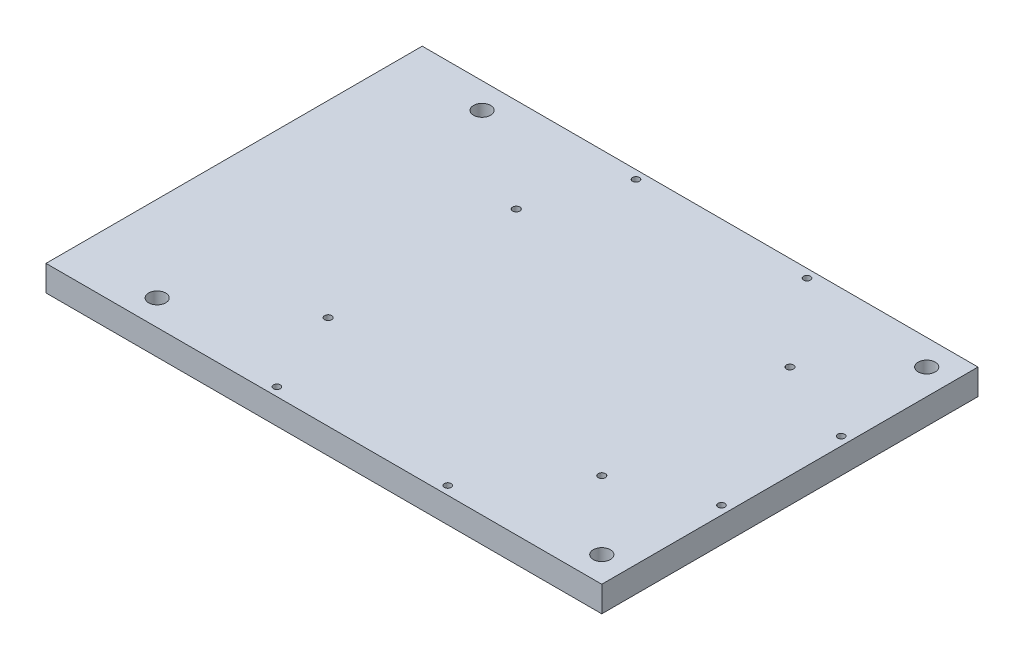
from build123d import *

# Parameters (mm, degrees)
SKETCH2_R                                    = 5
BOSS_EXTRUDE3_DEPTH                          = 15
SKETCH11_W                                   = 50
SKETCH11_H                                   = 75
SKETCH11_W_2                                 = 70
SKETCH11_H_2                                 = 90
CUT_EXTRUDE6_DEPTH                           = 5
FILLET1_R                                    = 5
CSK_FOR_M4_COUNTERSUNK_FLAT_HEAD_SCR_2_COUNT = 2
CSK_FOR_M4_COUNTERSUNK_FLAT_HEAD_SCR_2_PITCH = 100
CSK_FOR_M4_COUNTERSUNK_FLAT_HEAD_SCR_3_COUNT = 2
CSK_FOR_M4_COUNTERSUNK_FLAT_HEAD_SCR_3_PITCH = 202.484567313
CSK_FOR_M4_COUNTERSUNK_FLAT_HEAD_SCR_4_COUNT = 2
CSK_FOR_M4_COUNTERSUNK_FLAT_HEAD_SCR_4_PITCH = 236.008474424
CSK_FOR_M4_COUNTERSUNK_FLAT_HEAD_SCR_5_COUNT = 2
CSK_FOR_M4_COUNTERSUNK_FLAT_HEAD_SCR_5_PITCH = 232.594066992
CSK_FOR_M4_COUNTERSUNK_FLAT_HEAD_SCR_6_COUNT = 2
CSK_FOR_M4_COUNTERSUNK_FLAT_HEAD_SCR_6_PITCH = 210
M5_TAPPED_HOLE2_D                            = 4.2
M5_TAPPED_HOLE2_DEPTH                        = 5
M5_TAPPED_HOLE2_TIP                          = 1.2618073
M6_TAPPED_HOLE3_D                            = 5
M6_TAPPED_HOLE3_DEPTH                        = 5
M6_TAPPED_HOLE3_TIP                          = 1.502151548


with BuildPart() as part:
    # Sketch2 → Boss-Extrude3 (new body)
    with BuildSketch(Plane(origin=(0, 0, 0), x_dir=(1, 0, 0), z_dir=(0, 1, 0))):
        Polygon((-154.903080262, 110), (-154.903080262, -110), (170.096919738, -110), (170.096919738, 35), (170.096919738, 110), align=None)
        with Locations((-104.903080262, -95)):
            Circle(SKETCH2_R, mode=Mode.SUBTRACT)
        with Locations((155.096919738, -95)):
            Circle(SKETCH2_R, mode=Mode.SUBTRACT)
        with Locations((-104.903080262, 95)):
            Circle(SKETCH2_R, mode=Mode.SUBTRACT)
        with Locations((155.096919738, 95)):
            Circle(SKETCH2_R, mode=Mode.SUBTRACT)
    extrude(amount=-BOSS_EXTRUDE3_DEPTH)

    # Sketch11 → Cut-Extrude6 (cut)
    with BuildSketch(Plane.XZ.offset(15)):
        Polygon((155.096919738, 80), (140.096919738, 80), (140.096919738, 95), (85.096919738, 95), (85.096919738, 5), (155.096919738, 5), align=None)
        Polygon((140.096919738, -80), (155.096919738, -80), (155.096919738, -5), (85.096919738, -5), (85.096919738, -95), (140.096919738, -95), align=None)
        with Locations((-109.903080262, -42.5)):
            Rectangle(SKETCH11_W, SKETCH11_H)
        with Locations((-109.903080262, 42.5)):
            Rectangle(SKETCH11_W, SKETCH11_H)
        with Locations((-39.903080262, -50)):
            Rectangle(SKETCH11_W_2, SKETCH11_H_2)
        with Locations((40.096919738, -50)):
            Rectangle(SKETCH11_W_2, SKETCH11_H_2)
        with Locations((-39.903080262, 50)):
            Rectangle(SKETCH11_W_2, SKETCH11_H_2)
        with Locations((40.096919738, 50)):
            Rectangle(SKETCH11_W_2, SKETCH11_H_2)
    extrude(amount=-CUT_EXTRUDE6_DEPTH, mode=Mode.SUBTRACT)

    # Fillet1
    fillet1_edges = [part.edges().sort_by_distance(p)[0] for p in [
        (5.096919738, -12.5, -5),
        (-74.903080262, -12.5, -5),
        (-134.903080262, -12.5, -5),
        (-134.903080262, -12.5, 80),
        (-74.903080262, -12.5, 95),
        (5.096919738, -12.5, 95),
        (85.096919738, -12.5, 5),
        (5.096919738, -12.5, 5),
        (-74.903080262, -12.5, 5),
        (-134.903080262, -12.5, 5),
        (-134.903080262, -12.5, -80),
        (-74.903080262, -12.5, -95),
        (5.096919738, -12.5, -95),
        (75.096919738, -12.5, -95),
        (-4.903080262, -12.5, -95),
        (-84.903080262, -12.5, -80),
        (-84.903080262, -12.5, 5),
        (-4.903080262, -12.5, 5),
        (75.096919738, -12.5, 5),
        (155.096919738, -12.5, 5),
        (140.096919738, -12.5, 80),
        (155.096919738, -12.5, 80),
        (140.096919738, -12.5, 95),
        (75.096919738, -12.5, 95),
        (-4.903080262, -12.5, 95),
        (-84.903080262, -12.5, 80),
        (-84.903080262, -12.5, -5),
        (-4.903080262, -12.5, -5),
        (75.096919738, -12.5, -5),
        (155.096919738, -12.5, -5),
        (85.096919738, -12.5, -5),
        (85.096919738, -12.5, -95),
        (140.096919738, -12.5, -95),
        (155.096919738, -12.5, -80),
        (140.096919738, -12.5, -80),
    ]]
    fillet(fillet1_edges, radius=FILLET1_R)

    # Sketch28 → CSK for M4 Countersunk Flat Head Screw2 (revolve, cut)
    with BuildSketch(Plane(origin=(-24.903080262, -15, -105), x_dir=(0, 0, -1), z_dir=(1, 0, 0))):
        Polygon((0, 0), (0, 15), (2, 15), (2, 2.2), (3.7, 0.5), (3.7, 0), align=None)
    csk_for_m4_countersunk_flat_head_screw2 = revolve(axis=Axis((-24.903080262, -21.35, -105), (0, 1, 0)), mode=Mode.SUBTRACT)

    # CSK for M4 Countersunk Flat Head Scr 2: CSK for M4 Countersunk Flat Head Screw2 ×2
    with Locations(*[(i * CSK_FOR_M4_COUNTERSUNK_FLAT_HEAD_SCR_2_PITCH, 0, 0) for i in range(1, CSK_FOR_M4_COUNTERSUNK_FLAT_HEAD_SCR_2_COUNT)]):
        add(csk_for_m4_countersunk_flat_head_screw2, mode=Mode.SUBTRACT)

    # CSK for M4 Countersunk Flat Head Scr 3: CSK for M4 Countersunk Flat Head Screw2 ×2
    with Locations(*[Vector(0.9383431168171102, 0, 0.34570535882735626) * (i * CSK_FOR_M4_COUNTERSUNK_FLAT_HEAD_SCR_3_PITCH) for i in range(1, CSK_FOR_M4_COUNTERSUNK_FLAT_HEAD_SCR_3_COUNT)]):
        add(csk_for_m4_countersunk_flat_head_screw2, mode=Mode.SUBTRACT)

    # CSK for M4 Countersunk Flat Head Scr 4: CSK for M4 Countersunk Flat Head Screw2 ×2
    with Locations(*[Vector(0.8050558373533682, 0, 0.59319903804985) * (i * CSK_FOR_M4_COUNTERSUNK_FLAT_HEAD_SCR_4_PITCH) for i in range(1, CSK_FOR_M4_COUNTERSUNK_FLAT_HEAD_SCR_4_COUNT)]):
        add(csk_for_m4_countersunk_flat_head_screw2, mode=Mode.SUBTRACT)

    # CSK for M4 Countersunk Flat Head Scr 5: CSK for M4 Countersunk Flat Head Screw2 ×2
    with Locations(*[Vector(0.42993358039234764, 0, 0.9028605188239304) * (i * CSK_FOR_M4_COUNTERSUNK_FLAT_HEAD_SCR_5_PITCH) for i in range(1, CSK_FOR_M4_COUNTERSUNK_FLAT_HEAD_SCR_5_COUNT)]):
        add(csk_for_m4_countersunk_flat_head_screw2, mode=Mode.SUBTRACT)

    # CSK for M4 Countersunk Flat Head Scr 6: CSK for M4 Countersunk Flat Head Screw2 ×2
    with Locations(*[(0, 0, i * CSK_FOR_M4_COUNTERSUNK_FLAT_HEAD_SCR_6_PITCH) for i in range(1, CSK_FOR_M4_COUNTERSUNK_FLAT_HEAD_SCR_6_COUNT)]):
        add(csk_for_m4_countersunk_flat_head_screw2, mode=Mode.SUBTRACT)

    # M5 Tapped Hole2
    with Locations(Plane(origin=(0, 0, 0), x_dir=(1, 0, 0), z_dir=(0, 1, 0))):
        with Locations((115.096919738, 55), (115.096919738, -55), (-44.903080262, -55), (-44.903080262, 55)):
            Hole(M5_TAPPED_HOLE2_D / 2, depth=M5_TAPPED_HOLE2_DEPTH)
            with Locations((0, 0, -(M5_TAPPED_HOLE2_DEPTH + M5_TAPPED_HOLE2_TIP / 2))):  # 118° drill point
                Cone(0, M5_TAPPED_HOLE2_D / 2, M5_TAPPED_HOLE2_TIP, mode=Mode.SUBTRACT)

    # M6 Tapped Hole3
    with Locations(Plane.ZY.offset(154.903080262)):
        with Locations((-102.5, -7.5), (0, -7.5), (102.5, -7.5)):
            Hole(M6_TAPPED_HOLE3_D / 2, depth=M6_TAPPED_HOLE3_DEPTH)
            with Locations((0, 0, -(M6_TAPPED_HOLE3_DEPTH + M6_TAPPED_HOLE3_TIP / 2))):  # 118° drill point
                Cone(0, M6_TAPPED_HOLE3_D / 2, M6_TAPPED_HOLE3_TIP, mode=Mode.SUBTRACT)


solid = part.part
